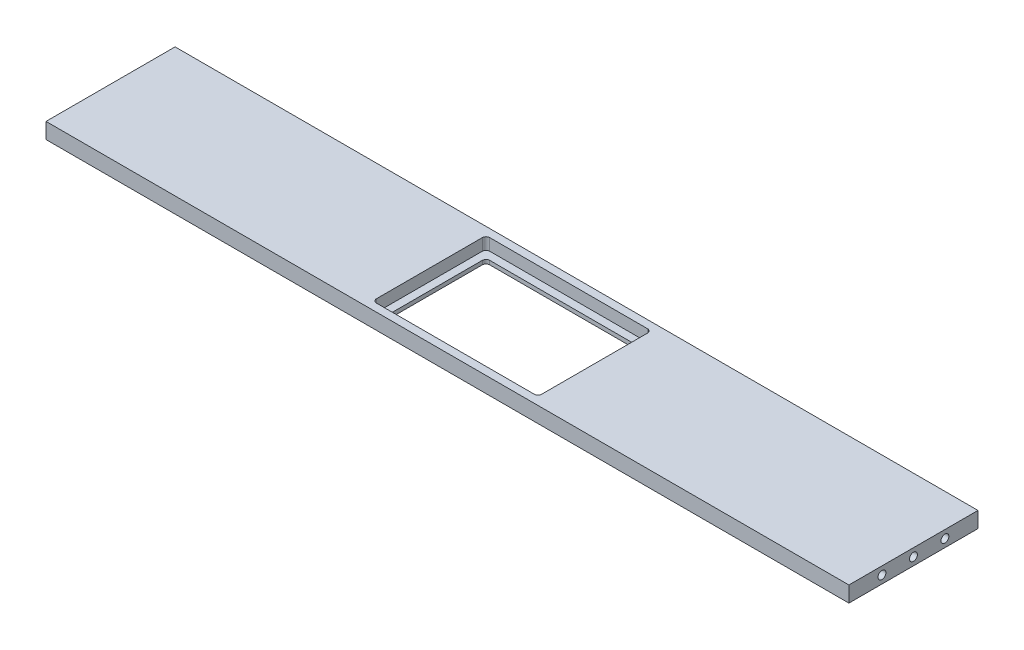
from build123d import *

# Parameters (mm, degrees)
SKETCH2_W                         = 647.7
SKETCH2_H                         = 12.7
BOSS_EXTRUDE1_DEPTH               = 52.07
CUT_EXTRUDE1_DEPTH                = 9.525
F_1_4_20_THREADED_HOLE_AT_2_COUNT = 2
F_1_4_20_THREADED_HOLE_AT_2_PITCH = 25.4
F_1_4_20_THREADED_HOLE_AT_3_COUNT = 2
F_1_4_20_THREADED_HOLE_AT_3_PITCH = 50.8
CUT_EXTRUDE2_DEPTH                = 329.255079778


with BuildPart() as part:
    # Sketch2 → Boss-Extrude1 (new, symmetric)
    with BuildSketch(Plane.XY):
        with Locations((0, -6.35)):
            Rectangle(SKETCH2_W, SKETCH2_H)
    extrude(amount=BOSS_EXTRUDE1_DEPTH, both=True)

    # Sketch3 → Cut-Extrude1 (cut)
    with BuildSketch(Plane(origin=(0, 0, 0), x_dir=(1, 0, 0), z_dir=(0, 1, 0))):
        with BuildLine():
            Line((63.675, 45.72), (-63.675, 45.72))
            ThreePointArc((-63.675, 45.72), (-65.796320344, 44.841320344), (-66.675, 42.72))
            Line((-66.675, 42.72), (-66.675, -42.72))
            ThreePointArc((-66.675, -42.72), (-65.796320344, -44.841320344), (-63.675, -45.72))
            Line((-63.675, -45.72), (63.675, -45.72))
            ThreePointArc((63.675, -45.72), (65.796320344, -44.841320344), (66.675, -42.72))
            Line((66.675, -42.72), (66.675, 42.72))
            ThreePointArc((66.675, 42.72), (65.796320344, 44.841320344), (63.675, 45.72))
        make_face()
    extrude(amount=-CUT_EXTRUDE1_DEPTH, mode=Mode.SUBTRACT)

    # Sketch6 → 1/4"-20 threaded hole (revolve, cut)
    with BuildSketch(Plane(origin=(-323.85, -6.35, -25.4), x_dir=(0, 0, 1), z_dir=(0, 1, 0))):
        Polygon((0, 0), (0, 52.707732465), (3.175, 50.8), (3.175, 0), align=None)
    f_1_4_20_threaded_hole = revolve(axis=Axis((-330.2, -6.35, -25.4), (1, 0, 0)), mode=Mode.SUBTRACT)

    # 1/4"-20 threaded hole at 2: 1/4"-20 threaded hole ×2
    with Locations(*[(0, 0, i * F_1_4_20_THREADED_HOLE_AT_2_PITCH) for i in range(1, F_1_4_20_THREADED_HOLE_AT_2_COUNT)]):
        add(f_1_4_20_threaded_hole, mode=Mode.SUBTRACT)

    # 1/4"-20 threaded hole at 3: 1/4"-20 threaded hole ×2
    with Locations(*[(0, 0, i * F_1_4_20_THREADED_HOLE_AT_3_PITCH) for i in range(1, F_1_4_20_THREADED_HOLE_AT_3_COUNT)]):
        add(f_1_4_20_threaded_hole, mode=Mode.SUBTRACT)

    # Mirror1: 1/4"-20 threaded hole across plane
    add(f_1_4_20_threaded_hole.mirror(Plane(origin=(0, 0, 0), x_dir=(0, 0, 1), z_dir=(1, 0, 0))), mode=Mode.SUBTRACT)

    # Mirror1 copy 1 sketch → Mirror1 copy 1 (revolve, cut)
    with BuildSketch(Plane(origin=(323.85, -6.35, 0), x_dir=(0, 0, 1), z_dir=(0, 1, 0))):
        Polygon((0, 0), (0, -52.707732465), (3.175, -50.8), (3.175, 0), align=None)
    revolve(axis=Axis((330.2, -6.35, 0), (1, 0, 0)), mode=Mode.SUBTRACT)

    # Mirror1 copy 2 sketch → Mirror1 copy 2 (revolve, cut)
    with BuildSketch(Plane(origin=(323.85, -6.35, 25.4), x_dir=(0, 0, 1), z_dir=(0, 1, 0))):
        Polygon((0, 0), (0, -52.707732465), (3.175, -50.8), (3.175, 0), align=None)
    revolve(axis=Axis((330.2, -6.35, 25.4), (1, 0, 0)), mode=Mode.SUBTRACT)

    # Sketch3<3> → Cut-Extrude2 (cut, through all)
    with BuildSketch(Plane(origin=(0, 0, 0), x_dir=(1, 0, 0), z_dir=(0, 1, 0))):
        with BuildLine():
            Line((57.325, 39.37), (-57.325, 39.37))
            ThreePointArc((-57.325, 39.37), (-59.446320344, 38.491320344), (-60.325, 36.37))
            Line((-60.325, 36.37), (-60.325, -36.37))
            ThreePointArc((-60.325, -36.37), (-59.446320344, -38.491320344), (-57.325, -39.37))
            Line((-57.325, -39.37), (57.325, -39.37))
            ThreePointArc((57.325, -39.37), (59.446320344, -38.491320344), (60.325, -36.37))
            Line((60.325, -36.37), (60.325, 36.37))
            ThreePointArc((60.325, 36.37), (59.446320344, 38.491320344), (57.325, 39.37))
        make_face()
    extrude(amount=-CUT_EXTRUDE2_DEPTH, mode=Mode.SUBTRACT)


solid = part.part
